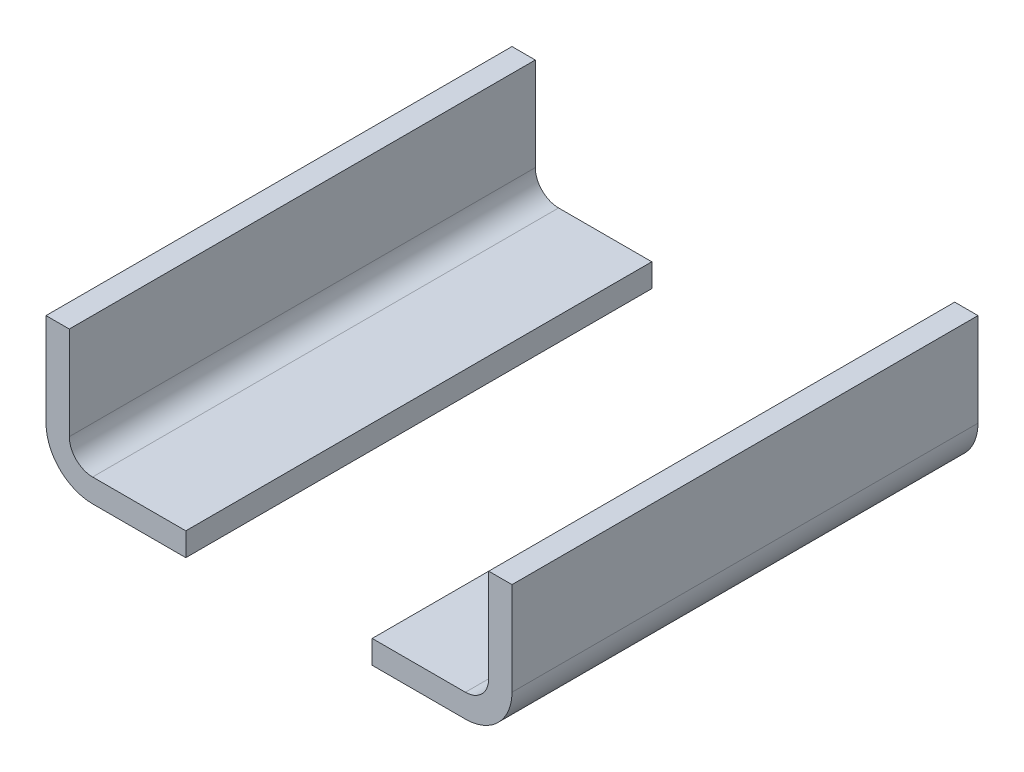
from build123d import *

# Parameters (mm, degrees)
SALIENTE_EXTRUIR1_DEPTH   = 200
SALIENTE_EXTRUIR1_2_DEPTH = 200


with BuildPart() as part:
    # Croquis1 → Saliente-Extruir1 (new body)
    with BuildSketch(Plane.XY):
        with BuildLine():
            Line((-40, 0), (-80, 0))
            ThreePointArc((-80, 0), (-94.142135624, 5.857864376), (-100, 20))
            Line((-100, 20), (-100, 60))
            Line((-100, 60), (-90, 60))
            Line((-90, 60), (-90, 20))
            ThreePointArc((-90, 20), (-87.071067812, 12.928932188), (-80, 10))
            Line((-80, 10), (-40, 10))
            Line((-40, 10), (-40, 0))
        make_face()
    extrude(amount=SALIENTE_EXTRUIR1_DEPTH)


with BuildPart() as body_2:
    # Croquis1 → Saliente-Extruir1 2 (new body)
    with BuildSketch(Plane.XY):
        with BuildLine():
            Line((40, 0), (80, 0))
            ThreePointArc((80, 0), (94.142135624, 5.857864376), (100, 20))
            Line((100, 20), (100, 60))
            Line((100, 60), (90, 60))
            Line((90, 60), (90, 20))
            ThreePointArc((90, 20), (87.071067812, 12.928932188), (80, 10))
            Line((80, 10), (40, 10))
            Line((40, 10), (40, 0))
        make_face()
    extrude(amount=SALIENTE_EXTRUIR1_2_DEPTH)


solid = Compound([part.part, body_2.part])
